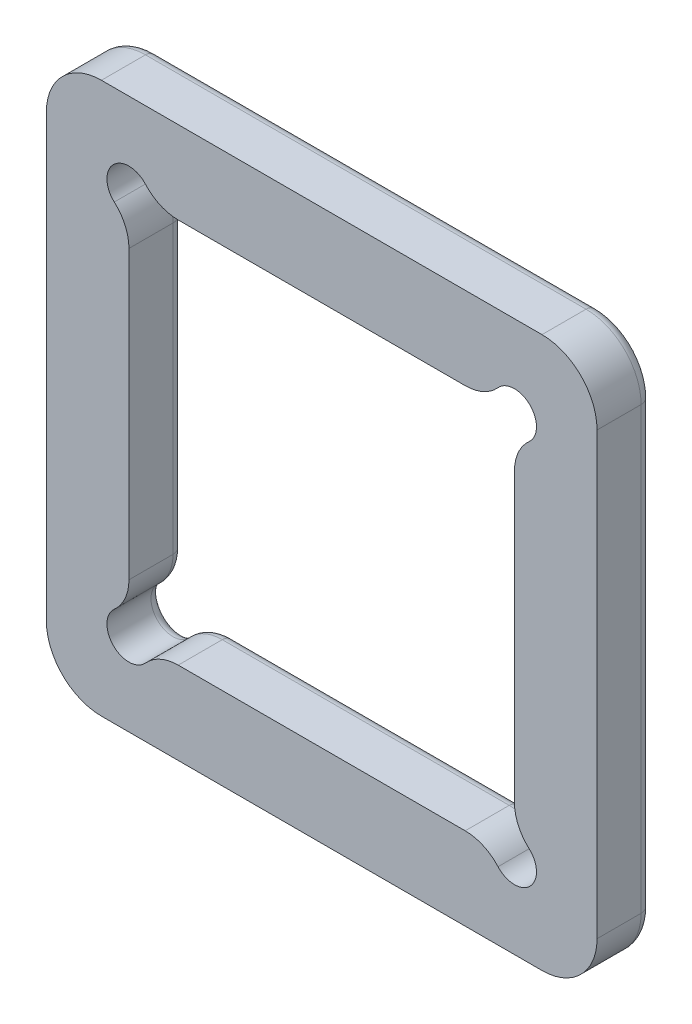
from build123d import *

# Parameters (mm, degrees)
CROQUIS1_W              = 100
CROQUIS1_H              = 100
SALIENTE_EXTRUIR1_DEPTH = 10
REDONDEO1_R             = 8
REDONDEO2_R             = 10
REDONDEO3_R             = 2
CROQUIS2_W              = 10
CROQUIS2_H              = 7
CROQUIS2_W_2            = 7
CROQUIS2_H_2            = 10
CORTAR_EXTRUIR1_DEPTH   = 7


with BuildPart() as part:
    # Croquis1 → Saliente-Extruir1 (new body)
    with BuildSketch(Plane.XY):
        with Locations((50, 50)):
            Rectangle(CROQUIS1_W, CROQUIS1_H)
        with BuildLine():
            Line((19, 15), (81, 15))
            ThreePointArc((81, 15), (87.828427125, 12.171572875), (85, 19))
            Line((85, 19), (85, 81))
            ThreePointArc((85, 81), (87.828427125, 87.828427125), (81, 85))
            Line((81, 85), (19, 85))
            ThreePointArc((19, 85), (12.171572875, 87.828427125), (15, 81))
            Line((15, 81), (15, 19))
            ThreePointArc((15, 19), (12.171572875, 12.171572875), (19, 15))
        make_face(mode=Mode.SUBTRACT)
    extrude(amount=SALIENTE_EXTRUIR1_DEPTH)

    # Redondeo1
    redondeo1_edges = [part.edges().sort_by_distance(p)[0] for p in [
        (15, 19, 5),
        (19, 15, 5),
        (81, 15, 5),
        (85, 19, 5),
        (85, 81, 5),
        (81, 85, 5),
        (19, 85, 5),
        (15, 81, 5),
    ]]
    fillet(redondeo1_edges, radius=REDONDEO1_R)

    # Redondeo2
    redondeo2_edges = [part.edges().sort_by_distance(p)[0] for p in [
        (0, 100, 5),
        (100, 100, 5),
        (100, 0, 5),
        (0, 0, 5),
    ]]
    fillet(redondeo2_edges, radius=REDONDEO2_R)

    # Redondeo3
    redondeo3_edges = [part.edges().sort_by_distance(p)[0] for p in [
        (87.828427125, 12.171572875, 0),
        (15, 50, 0),
        (12.171572875, 12.171572875, 0),
        (50, 15, 0),
        (85, 50, 0),
        (87.828427125, 87.828427125, 0),
        (50, 85, 0),
        (12.171572875, 87.828427125, 0),
        (85.697032567, 79.321714414, 0),
        (79.321714414, 85.697032567, 0),
        (20.678285586, 85.697032567, 0),
        (14.302967433, 79.321714414, 0),
        (20.678285586, 14.302967433, 0),
        (14.302967433, 20.678285586, 0),
        (79.321714414, 14.302967433, 0),
        (85.697032567, 20.678285586, 0),
        (50, 100, 0),
        (0, 50, 0),
        (100, 50, 0),
        (50, 0, 0),
        (97.071067812, 2.928932188, 0),
        (2.928932188, 2.928932188, 0),
        (2.928932188, 97.071067812, 0),
        (97.071067812, 97.071067812, 0),
    ]]
    fillet(redondeo3_edges, radius=REDONDEO3_R)

    # Croquis2 → Cortar-Extruir1 (cut)
    with BuildSketch(Plane(origin=(0, 0, 0), x_dir=(-1, 0, 0), z_dir=(0, 0, -1))):
        with Locations((-30, 7.5)):
            Rectangle(CROQUIS2_W, CROQUIS2_H)
        with Locations((-50, 7.5)):
            Rectangle(CROQUIS2_W, CROQUIS2_H)
        with Locations((-70, 7.5)):
            Rectangle(CROQUIS2_W, CROQUIS2_H)
        with Locations((-92.5, 30)):
            Rectangle(CROQUIS2_W_2, CROQUIS2_H_2)
        with Locations((-92.5, 50)):
            Rectangle(CROQUIS2_W_2, CROQUIS2_H_2)
        with Locations((-92.5, 70)):
            Rectangle(CROQUIS2_W_2, CROQUIS2_H_2)
        with Locations((-7.5, 30)):
            Rectangle(CROQUIS2_W_2, CROQUIS2_H_2)
        with Locations((-7.5, 50)):
            Rectangle(CROQUIS2_W_2, CROQUIS2_H_2)
        with Locations((-7.5, 70)):
            Rectangle(CROQUIS2_W_2, CROQUIS2_H_2)
        with Locations((-30, 92.5)):
            Rectangle(CROQUIS2_W, CROQUIS2_H)
        with Locations((-50, 92.5)):
            Rectangle(CROQUIS2_W, CROQUIS2_H)
        with Locations((-70, 92.5)):
            Rectangle(CROQUIS2_W, CROQUIS2_H)
    extrude(amount=-CORTAR_EXTRUIR1_DEPTH, mode=Mode.SUBTRACT)


solid = part.part
